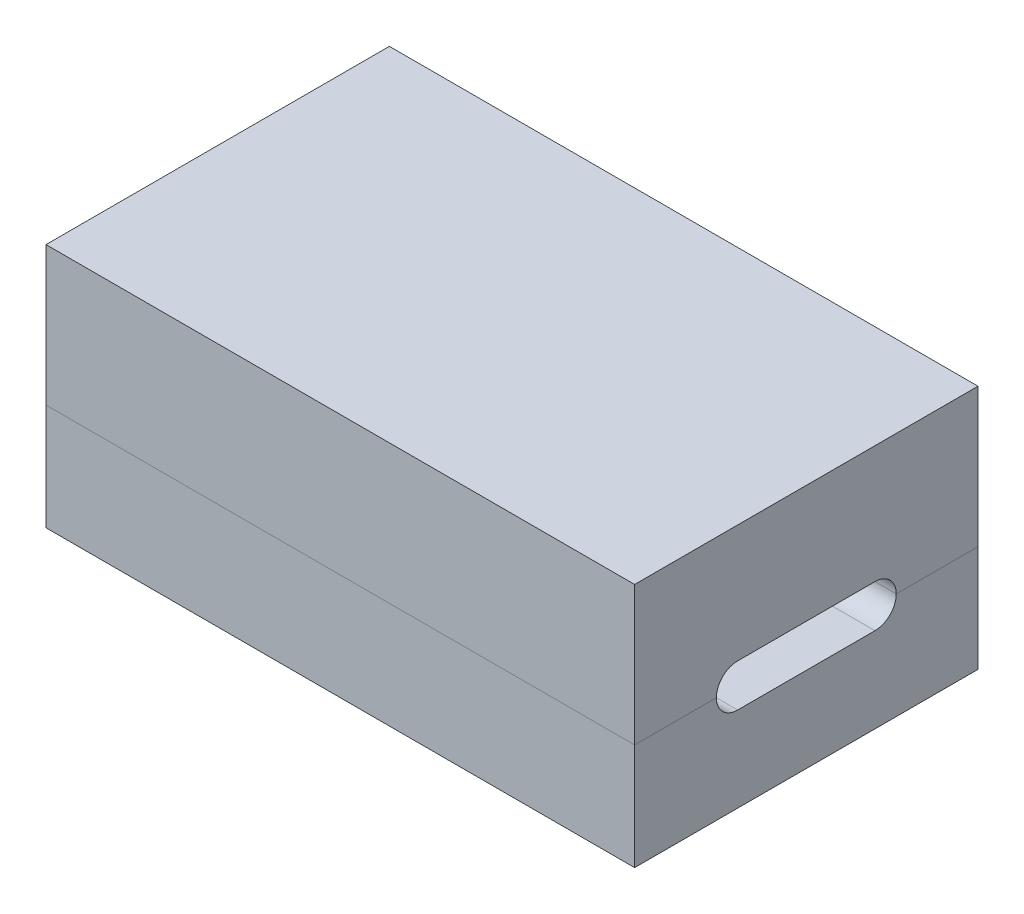
from build123d import *

# Parameters (mm, degrees)
SKETCH1_W           = 36
SKETCH1_H           = 21
BOSS_EXTRUDE2_DEPTH = 15
CUT_EXTRUDE1_DEPTH  = 15
SKETCH5_W           = 30
SKETCH5_H           = 15
CUT_EXTRUDE2_DEPTH  = 3.5
SKETCH7_W           = 30
SKETCH7_H           = 15
CUT_EXTRUDE3_DEPTH  = 5.5


with BuildPart() as part:
    # Sketch1 → Boss-Extrude2 (new body)
    with BuildSketch(Plane(origin=(0, 0, 0), x_dir=(1, 0, 0), z_dir=(0, 1, 0))):
        Rectangle(SKETCH1_W, SKETCH1_H)
    extrude(amount=BOSS_EXTRUDE2_DEPTH)

    # Sketch2 → Cut-Extrude1 (cut)
    with BuildSketch(Plane(origin=(18, 0, 0), x_dir=(0, 0, -1), z_dir=(1, 0, 0))):
        with BuildLine():
            Line((-4.2, 7.8), (4.2, 7.8))
            ThreePointArc((4.2, 7.8), (5.5, 6.5), (4.2, 5.2))
            Line((4.2, 5.2), (-4.2, 5.2))
            ThreePointArc((-4.2, 5.2), (-5.5, 6.5), (-4.2, 7.8))
        make_face()
    extrude(amount=-CUT_EXTRUDE1_DEPTH, mode=Mode.SUBTRACT)


with BuildPart() as body_2:
    # Split1: the piece on the far side of the plane
    add(part.part)
    split(bisect_by=Plane.ZX.offset(6.5), keep=Keep.BOTTOM)

    # Sketch5 → Cut-Extrude2 (cut)
    with BuildSketch(Plane(origin=(0, 6.5, 0), x_dir=(1, 0, 0), z_dir=(0, 1, 0))):
        Rectangle(SKETCH5_W, SKETCH5_H)
    extrude(amount=-CUT_EXTRUDE2_DEPTH, mode=Mode.SUBTRACT)


with BuildPart() as part_1:
    add(part.part)

    # Split1
    split(bisect_by=Plane.ZX.offset(6.5), keep=Keep.TOP)

    # Sketch7 → Cut-Extrude3 (cut)
    with BuildSketch(Plane.XZ.offset(-6.5)):
        Rectangle(SKETCH7_W, SKETCH7_H)
    extrude(amount=-CUT_EXTRUDE3_DEPTH, mode=Mode.SUBTRACT)


solid = Compound([body_2.part, part_1.part])
